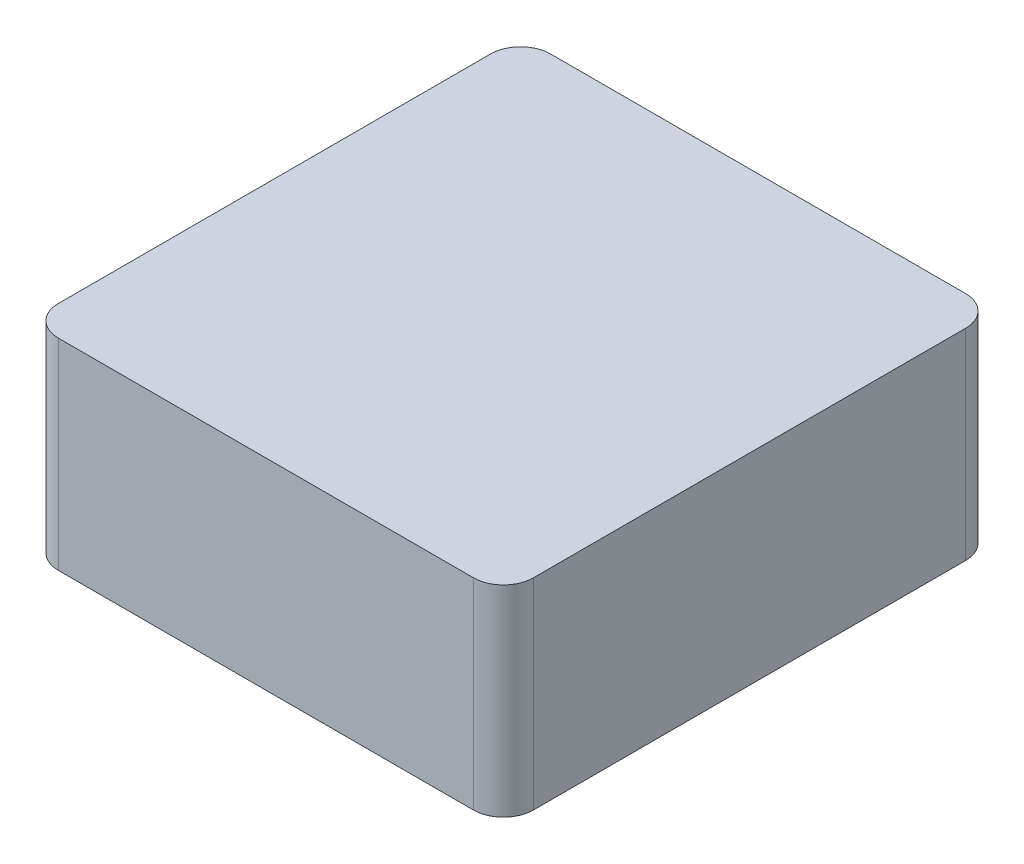
from build123d import *

# Parameters (mm, degrees)
BOSS_EXTRUDE1_DEPTH       = 23.5
SKETCH4_R                 = 6
BOSS_EXTRUDE2_DEPTH       = 3.25
M3X0_5_TAPPED_HOLE1_D     = 2.5
M3X0_5_TAPPED_HOLE1_DEPTH = 4.5
M3X0_5_TAPPED_HOLE1_TIP   = 0.751075774


with BuildPart() as part:
    # Sketch3 → Boss-Extrude1 (new, symmetric)
    with BuildSketch(Plane(origin=(0, 0, 0), x_dir=(1, 0, 0), z_dir=(0, 1, 0))):
        with BuildLine():
            Line((-48.5, 57.5), (48.5, 57.5))
            ThreePointArc((48.5, 57.5), (53.449747468, 55.449747468), (55.5, 50.5))
            Line((55.5, 50.5), (55.5, -50.5))
            ThreePointArc((55.5, -50.5), (53.449747468, -55.449747468), (48.5, -57.5))
            Line((48.5, -57.5), (-48.5, -57.5))
            ThreePointArc((-48.5, -57.5), (-53.449747468, -55.449747468), (-55.5, -50.5))
            Line((-55.5, -50.5), (-55.5, 50.5))
            ThreePointArc((-55.5, 50.5), (-53.449747468, 55.449747468), (-48.5, 57.5))
        make_face()
    extrude(amount=BOSS_EXTRUDE1_DEPTH, both=True)

    # Sketch4 → Boss-Extrude2 (add)
    with BuildSketch(Plane.XZ.offset(23.5)):
        with Locations(Location((45, 47.5, 0), (0, 0, 90))):
            Circle(SKETCH4_R)
        with Locations(Location((-45, 47.5, 0), (0, 0, 90))):
            Circle(SKETCH4_R)
        with Locations(Location((-45, -47.5, 0), (0, 0, 90))):
            Circle(SKETCH4_R)
        with Locations(Location((45, -47.5, 0), (0, 0, 90))):
            Circle(SKETCH4_R)
    extrude(amount=BOSS_EXTRUDE2_DEPTH)

    # M3x0.5 Tapped Hole1
    with Locations(Plane(origin=(0, -23.5, 0), x_dir=(-1, 0, 0), z_dir=(0, -1, 0))):
        with Locations((-42.5, 0), (42.5, 0)):
            Hole(M3X0_5_TAPPED_HOLE1_D / 2, depth=M3X0_5_TAPPED_HOLE1_DEPTH)
            with Locations((0, 0, -(M3X0_5_TAPPED_HOLE1_DEPTH + M3X0_5_TAPPED_HOLE1_TIP / 2))):  # 118° drill point
                Cone(0, M3X0_5_TAPPED_HOLE1_D / 2, M3X0_5_TAPPED_HOLE1_TIP, mode=Mode.SUBTRACT)


solid = part.part
